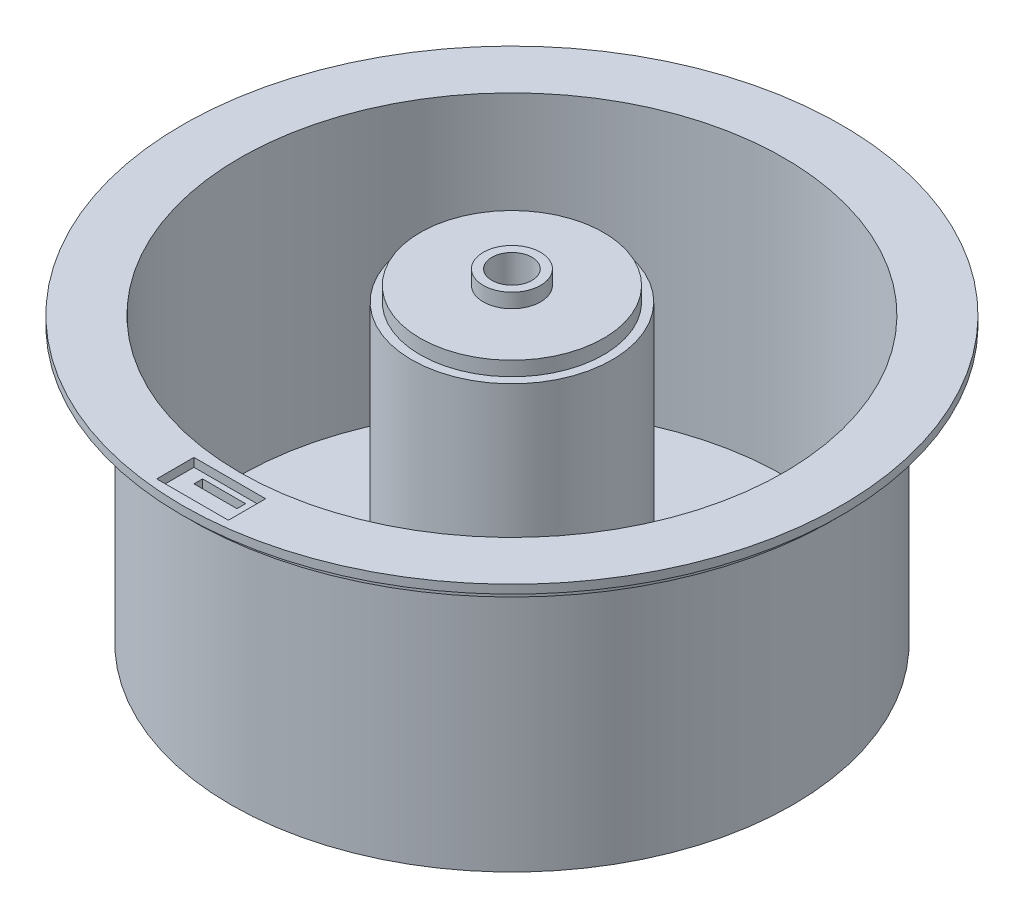
from build123d import *

# Parameters (mm, degrees)
SKETCH2_R           = 115
BOSS_EXTRUDE1_DEPTH = 3
SKETCH3_R           = 112
BOSS_EXTRUDE2_DEPTH = 3
SKETCH4_R           = 98
BOSS_EXTRUDE3_DEPTH = 93
SKETCH5_R           = 95
CUT_EXTRUDE1_DEPTH  = 96
SKETCH6_R           = 35
BOSS_EXTRUDE4_DEPTH = 100
SKETCH7_R           = 32
BOSS_EXTRUDE5_DEPTH = 5
SKETCH8_R           = 32
CUT_EXTRUDE2_DEPTH  = 99
SKETCH9_R           = 28
CUT_EXTRUDE3_DEPTH  = 4
SKETCH10_R          = 10
BOSS_EXTRUDE8_DEPTH = 5
SKETCH11_R          = 7
CUT_EXTRUDE4_DEPTH  = 35
SKETCH13_W          = 25
SKETCH13_H          = 13
CUT_EXTRUDE5_DEPTH  = 10
SKETCH14_W          = 15
SKETCH14_H          = 3
CUT_EXTRUDE7_DEPTH  = 10


with BuildPart() as part:
    # Sketch2 → Boss-Extrude1 (new body)
    with BuildSketch(Plane(origin=(0, 0, 0), x_dir=(1, 0, 0), z_dir=(0, 1, 0))):
        with Locations(Location((0, 0, 0), (0, 0, 270))):
            Circle(SKETCH2_R)
    extrude(amount=BOSS_EXTRUDE1_DEPTH)

    # Sketch3 → Boss-Extrude2 (add)
    with BuildSketch(Plane(origin=(0, 0, 0), x_dir=(-1, 0, 0), z_dir=(0, -1, 0))):
        with Locations(Location((0, 0, 0), (0, 0, 90))):
            Circle(SKETCH3_R)
    extrude(amount=BOSS_EXTRUDE2_DEPTH)

    # Sketch4 → Boss-Extrude3 (add)
    with BuildSketch(Plane.XZ.offset(3)):
        with Locations(Location((0, 0, 0), (0, 0, 270))):
            Circle(SKETCH4_R)
    extrude(amount=BOSS_EXTRUDE3_DEPTH)

    # Sketch5 → Cut-Extrude1 (cut)
    with BuildSketch(Plane(origin=(0, 3, 0), x_dir=(1, 0, 0), z_dir=(0, 1, 0))):
        with Locations(Location((0, 0, 0), (0, 0, 270))):
            Circle(SKETCH5_R)
    extrude(amount=-CUT_EXTRUDE1_DEPTH, mode=Mode.SUBTRACT)

    # Sketch6 → Boss-Extrude4 (add)
    with BuildSketch(Plane(origin=(0, -93, 0), x_dir=(1, 0, 0), z_dir=(0, 1, 0))):
        with Locations(Location((0, 0, 0), (0, 0, 270))):
            Circle(SKETCH6_R)
    extrude(amount=BOSS_EXTRUDE4_DEPTH)

    # Sketch7 → Boss-Extrude5 (add)
    with BuildSketch(Plane(origin=(0, 7, 0), x_dir=(1, 0, 0), z_dir=(0, 1, 0))):
        with Locations(Location((0, 0, 0), (0, 0, 270))):
            Circle(SKETCH7_R)
    extrude(amount=BOSS_EXTRUDE5_DEPTH)

    # Sketch8 → Cut-Extrude2 (cut)
    with BuildSketch(Plane.XZ.offset(96)):
        with Locations(Location((0, 0, 0), (0, 0, 90))):
            Circle(SKETCH8_R)
    extrude(amount=-CUT_EXTRUDE2_DEPTH, mode=Mode.SUBTRACT)

    # Sketch9 → Cut-Extrude3 (cut)
    with BuildSketch(Plane.XZ.offset(-3)):
        with Locations(Location((0, 0, 0), (0, 0, 270))):
            Circle(SKETCH9_R)
    extrude(amount=-CUT_EXTRUDE3_DEPTH, mode=Mode.SUBTRACT)

    # Sketch10 → Boss-Extrude8 (add)
    with BuildSketch(Plane(origin=(0, 12, 0), x_dir=(1, 0, 0), z_dir=(0, 1, 0))):
        with Locations(Location((0, 0, 0), (0, 0, 270))):
            Circle(SKETCH10_R)
    extrude(amount=BOSS_EXTRUDE8_DEPTH)

    # Sketch11 → Cut-Extrude4 (cut)
    with BuildSketch(Plane(origin=(0, 17, 0), x_dir=(1, 0, 0), z_dir=(0, 1, 0))):
        with Locations(Location((0, 0, 0), (0, 0, 270))):
            Circle(SKETCH11_R)
    extrude(amount=-CUT_EXTRUDE4_DEPTH, mode=Mode.SUBTRACT)

    # Sketch13 → Cut-Extrude5 (cut)
    with BuildSketch(Plane(origin=(0, 10, 0), x_dir=(1, 0, 0), z_dir=(0, 1, 0))):
        with Locations((0, -104.95033264)):
            Rectangle(SKETCH13_W, SKETCH13_H)
    extrude(amount=-CUT_EXTRUDE5_DEPTH, mode=Mode.SUBTRACT)

    # Sketch14 → Cut-Extrude7 (cut)
    with BuildSketch(Plane(origin=(0, 0, 0), x_dir=(1, 0, 0), z_dir=(0, 1, 0))):
        with Locations((0, -101.95033264)):
            Rectangle(SKETCH14_W, SKETCH14_H)
    extrude(amount=-CUT_EXTRUDE7_DEPTH, mode=Mode.SUBTRACT)


solid = part.part
